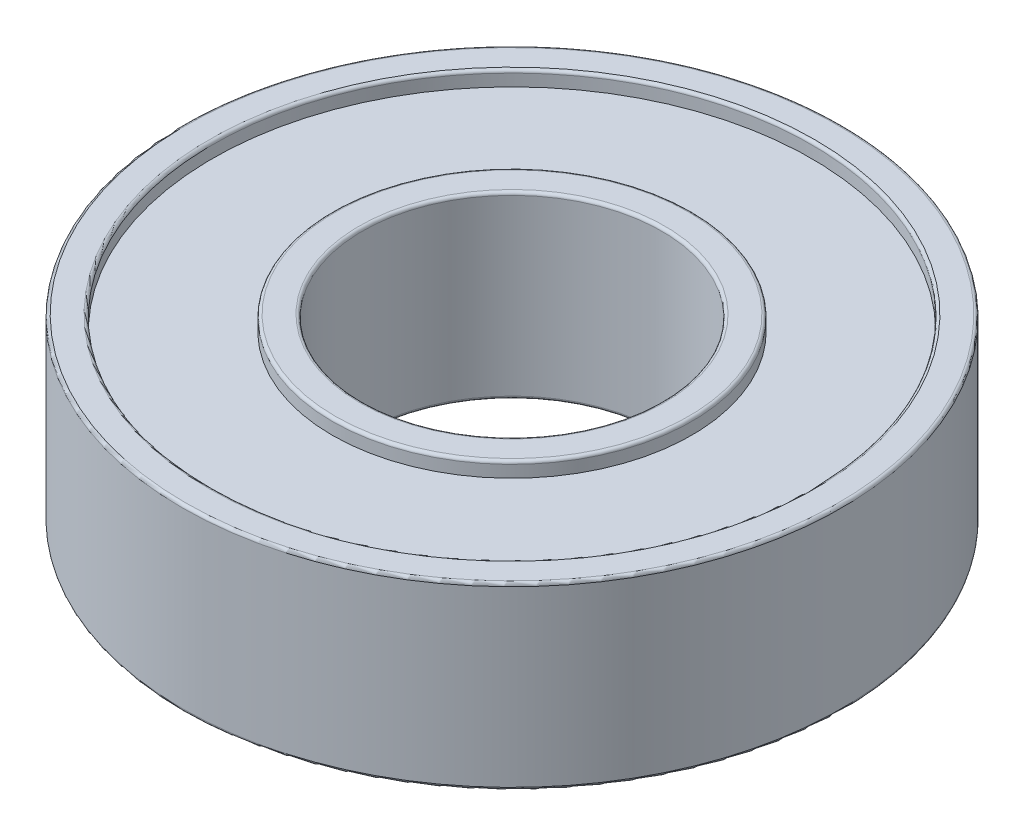
from build123d import *


with BuildPart() as part:
    # 草图1 → 旋转1 (revolve)
    with BuildSketch(Plane(origin=(0, 0, 0), x_dir=(-1, 0, 0), z_dir=(0, 0, -1)), mode=Mode.PRIVATE) as revolve_1_sk:
        with BuildLine():
            Line((-5.1, 3), (-5.9, 3))
            ThreePointArc((-5.9, 3), (-5.970710678, 2.970710678), (-6, 2.9))
            Line((-6, 2.9), (-6, 2.5))
            Line((-6, 2.5), (-10, 2.5))
            Line((-10, 2.5), (-10, 2.9))
            ThreePointArc((-10, 2.9), (-10.029289322, 2.970710678), (-10.1, 3))
            Line((-10.1, 3), (-10.9, 3))
            ThreePointArc((-10.9, 3), (-10.970710678, 2.970710678), (-11, 2.9))
            Line((-11, 2.9), (-11, -2.9))
            ThreePointArc((-11, -2.9), (-10.970710678, -2.970710678), (-10.9, -3))
            Line((-10.9, -3), (-10.1, -3))
            ThreePointArc((-10.1, -3), (-10.029289322, -2.970710678), (-10, -2.9))
            Line((-10, -2.9), (-10, -2.5))
            Line((-10, -2.5), (-6, -2.5))
            Line((-6, -2.5), (-6, -2.9))
            ThreePointArc((-6, -2.9), (-5.970710678, -2.970710678), (-5.9, -3))
            Line((-5.9, -3), (-5.1, -3))
            ThreePointArc((-5.1, -3), (-5.029289322, -2.970710678), (-5, -2.9))
            Line((-5, -2.9), (-5, 2.9))
            ThreePointArc((-5, 2.9), (-5.029289322, 2.970710678), (-5.1, 3))
        make_face()
    revolve(revolve_1_sk.sketch.rotate(Axis((0, -3, 0), (0, 1, 0)), 270), axis=Axis((0, -3, 0), (0, 1, 0)))


solid = part.part
